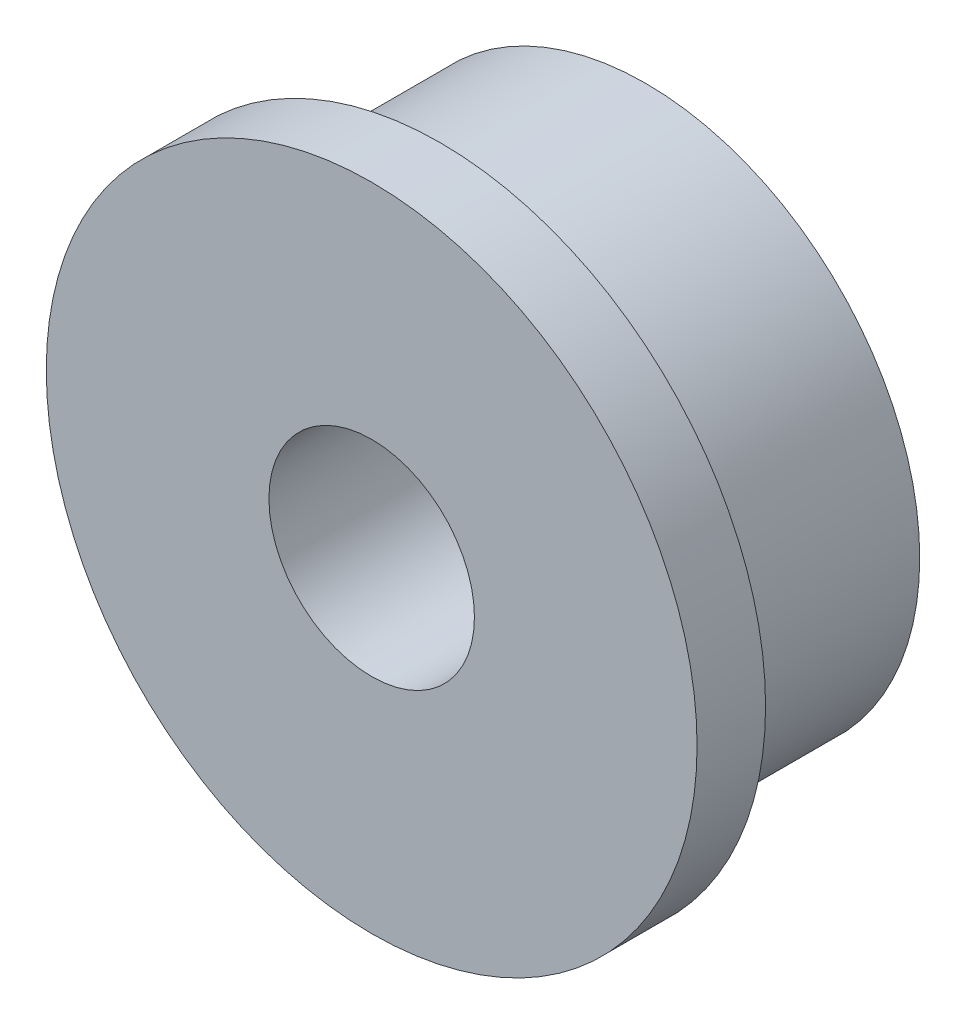
from build123d import *

# Parameters (mm, degrees)
SKETCH_1_R          = 4.75
EXTRUDE_1_DEPTH     = 1
SKETCH_2_R          = 4
EXTRUDE_2_DEPTH     = 4
SKETCH_5_R          = 1.5
CUT_EXTRUDE_1_DEPTH = 8.818247886


with BuildPart() as part:
    # 草图1 → 凸台-拉伸1 (new body)
    with BuildSketch(Plane.XY):
        Circle(SKETCH_1_R)
    extrude(amount=-EXTRUDE_1_DEPTH)

    # 草图2 → 凸台-拉伸2 (add)
    with BuildSketch(Plane.XY):
        Circle(SKETCH_2_R)
    extrude(amount=-EXTRUDE_2_DEPTH)

    # 草图5 → 切除-拉伸1 (cut, through all)
    with BuildSketch(Plane.XY):
        Circle(SKETCH_5_R)
    extrude(amount=-CUT_EXTRUDE_1_DEPTH, mode=Mode.SUBTRACT)


solid = part.part
